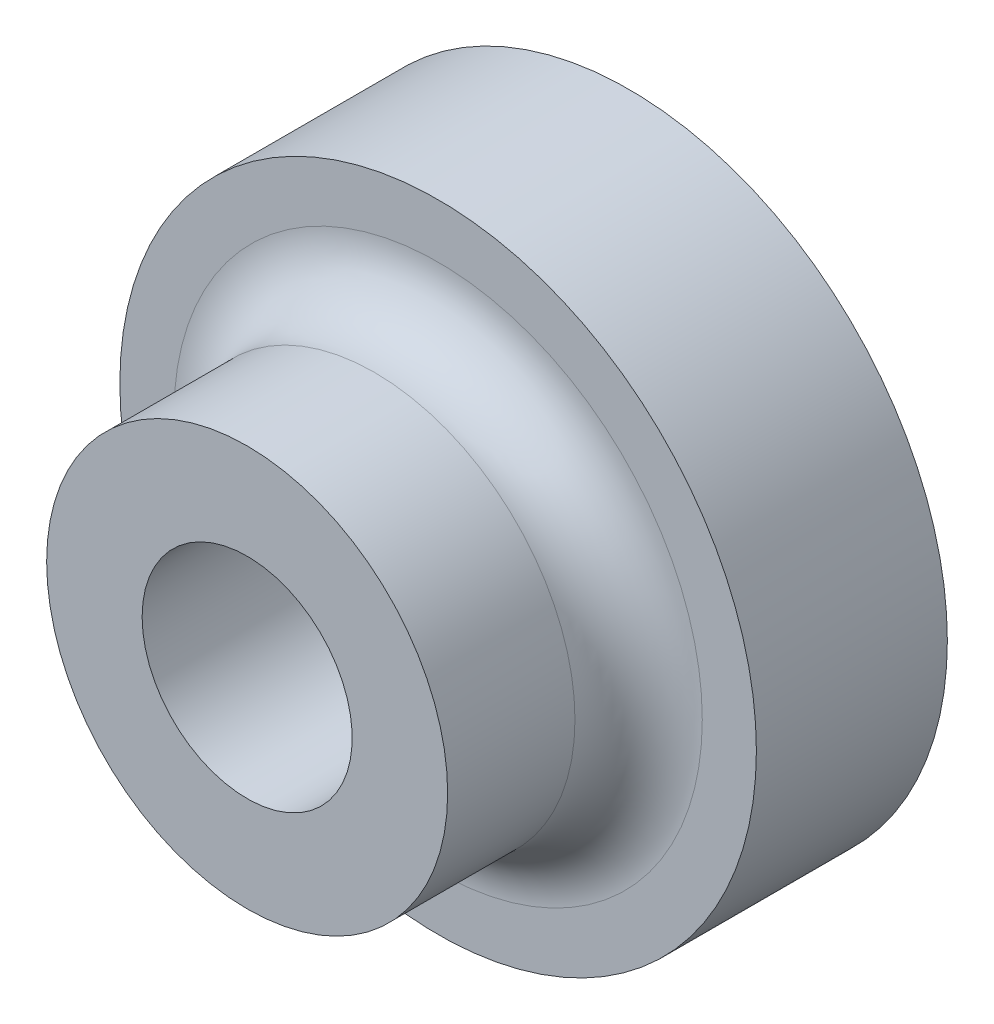
from build123d import *

# Parameters (mm, degrees)
SKETCH1_R           = 3.15
BOSS_EXTRUDE1_DEPTH = 3
SKETCH2_R           = 5
BOSS_EXTRUDE2_DEPTH = 3
FILLET1_R           = 1
CUT_EXTRUDE1_REACH  = 11.274
SKETCH3_R           = 1.65
SKETCH4_R           = 3
CUT_EXTRUDE2_DEPTH  = 2.5


with BuildPart() as part:
    # Sketch1 → Boss-Extrude1 (new body)
    with BuildSketch(Plane.XY):
        Circle(SKETCH1_R)
    extrude(amount=BOSS_EXTRUDE1_DEPTH)

    # Sketch2 → Boss-Extrude2 (add)
    with BuildSketch(Plane(origin=(0, 0, 0), x_dir=(-1, 0, 0), z_dir=(0, 0, -1))):
        Circle(SKETCH2_R)
    extrude(amount=BOSS_EXTRUDE2_DEPTH)

    # Fillet1
    fillet1_edges = [part.edges().sort_by_distance(p)[0] for p in [
        (-3.15, 0, 0),
    ]]
    fillet(fillet1_edges, radius=FILLET1_R)

    # Sketch3 → Cut-Extrude1 (cut, up to next)
    with BuildSketch(Plane(origin=(0, 0, -3), x_dir=(-1, 0, 0), z_dir=(0, 0, -1)), mode=Mode.PRIVATE) as cut_extrude1_sk1:
        Circle(SKETCH3_R)
    cut_extrude1_tool1 = extrude(cut_extrude1_sk1.sketch, amount=-CUT_EXTRUDE1_REACH, mode=Mode.PRIVATE) & part.part
    add(cut_extrude1_tool1.solids().sort_by_distance((0, 0, -3))[0], mode=Mode.SUBTRACT)

    # Sketch4 → Cut-Extrude2 (cut)
    with BuildSketch(Plane(origin=(0, 0, -3), x_dir=(-1, 0, 0), z_dir=(0, 0, -1))):
        Circle(SKETCH4_R)
    extrude(amount=-CUT_EXTRUDE2_DEPTH, mode=Mode.SUBTRACT)


solid = part.part
